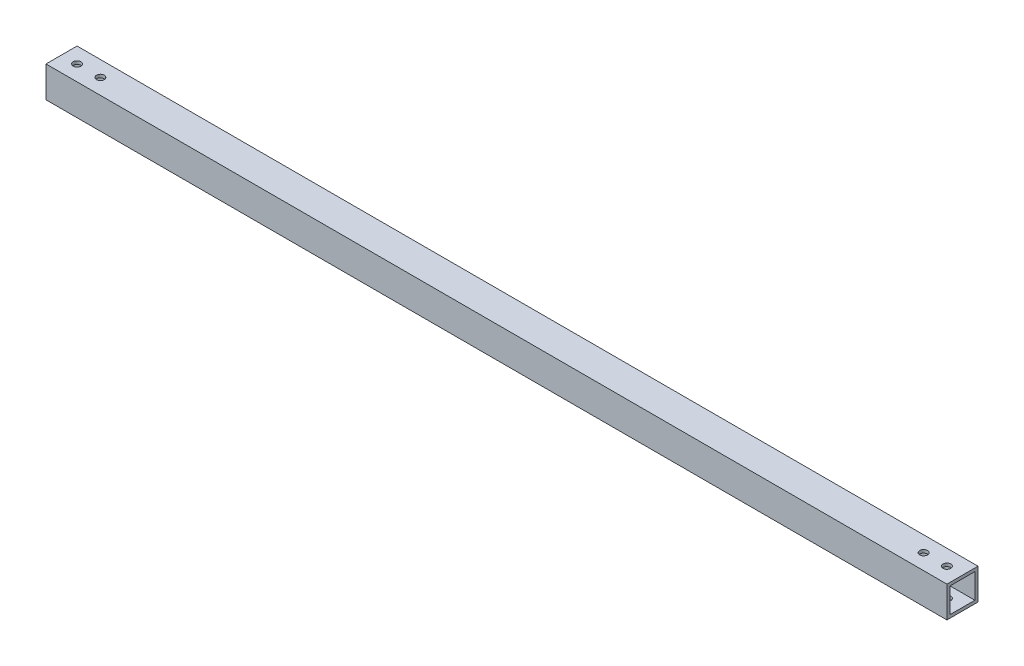
from build123d import *

# Parameters (mm, degrees)
SKETCH1_W           = 20
SKETCH1_H           = 20
SKETCH1_W_2         = 16
SKETCH1_H_2         = 16
BOSS_EXTRUDE1_DEPTH = 580
SKETCH2_R           = 2.5
CUT_EXTRUDE1_DEPTH  = 581.430874437


with BuildPart() as part:
    # Sketch1 → Boss-Extrude1 (new body)
    with BuildSketch(Plane(origin=(0, 0, 0), x_dir=(0, 0, -1), z_dir=(1, 0, 0))):
        Rectangle(SKETCH1_W, SKETCH1_H)
        Rectangle(SKETCH1_W_2, SKETCH1_H_2, mode=Mode.SUBTRACT)
    extrude(amount=BOSS_EXTRUDE1_DEPTH)

    # Sketch2 → Cut-Extrude1 (cut, through all)
    with BuildSketch(Plane(origin=(0, 10, 0), x_dir=(1, 0, 0), z_dir=(0, 1, 0))):
        with Locations(Location((10, 0, 0), (0, 0, 270))):
            Circle(SKETCH2_R)
        with Locations(Location((570, 0, 0), (0, 0, 270))):
            Circle(SKETCH2_R)
        with Locations(Location((25, 0, 0), (0, 0, 270))):
            Circle(SKETCH2_R)
        with Locations(Location((555, 0, 0), (0, 0, 270))):
            Circle(SKETCH2_R)
    extrude(amount=-CUT_EXTRUDE1_DEPTH, mode=Mode.SUBTRACT)


solid = part.part
